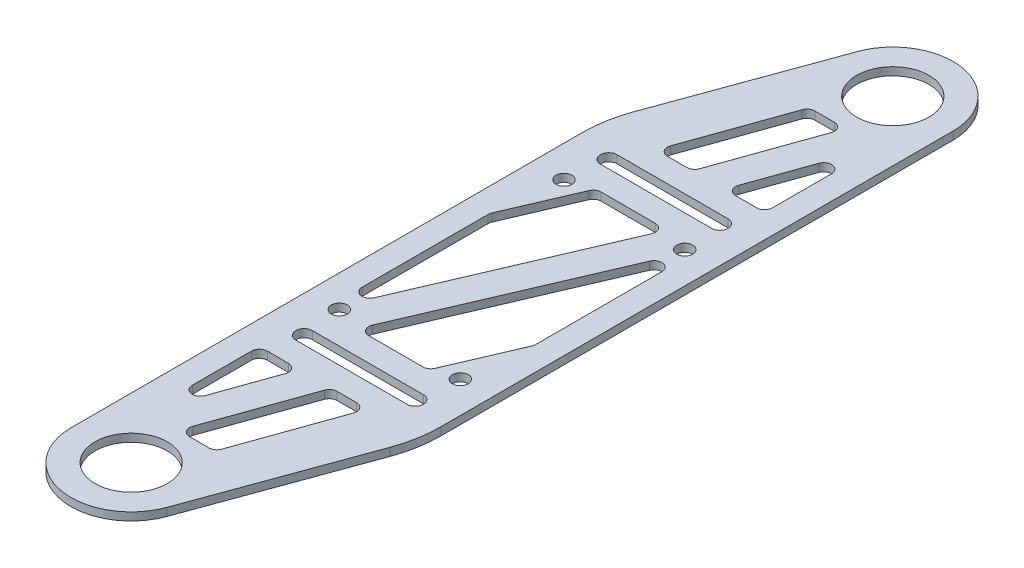
from build123d import *

# Parameters (mm, degrees)
SKETCH1_R           = 14.478
SKETCH1_R_2         = 3.175
BOSS_EXTRUDE1_DEPTH = 3.175
CUT_EXTRUDE1_DEPTH  = 168.948797034


with BuildPart() as part:
    # Sketch1 → Boss-Extrude1 (new body)
    with BuildSketch(Plane(origin=(0, 0, 0), x_dir=(1, 0, 0), z_dir=(0, 1, 0))):
        with BuildLine():
            Line((-36.83, 65.023620999), (-36.83, -139.7))
            ThreePointArc((-36.83, -139.7), (-16.890130527, -163.46341108), (9.97478294, -147.952946058))
            Line((9.97478294, -147.952946058), (33.766385136, -82.586056251))
            ThreePointArc((33.766385136, -82.586056251), (36.058233853, -74.032760396), (36.83, -65.21143297))
            Line((36.83, -65.21143297), (36.83, 139.7))
            ThreePointArc((36.83, 139.7), (17.75430807, 163.29472123), (-9.312633231, 149.584375461))
            Line((-9.312633231, 149.584375461), (-10.51620944, 146.277577002))
            Line((-10.51620944, 146.277577002), (-33.766385136, 82.39824428))
            ThreePointArc((-33.766385136, 82.39824428), (-36.058233853, 73.844948425), (-36.83, 65.023620999))
        make_face()
        with Locations(Location((-12.7, -139.7, 0), (0, 0, 270))):
            Circle(SKETCH1_R, mode=Mode.SUBTRACT)
        with Locations(Location((-24.13, -44.958, 0), (0, 0, 270))):
            Circle(SKETCH1_R_2, mode=Mode.SUBTRACT)
        with BuildLine():
            Line((22.225, -64.262), (-22.225, -64.262))
            ThreePointArc((-22.225, -64.262), (-25.527, -60.96), (-22.225, -57.658))
            Line((-22.225, -57.658), (22.225, -57.658))
            ThreePointArc((22.225, -57.658), (25.527, -60.96), (22.225, -64.262))
        make_face(mode=Mode.SUBTRACT)
        with Locations(Location((24.242138156, -44.897632473, 0), (0, 0, 270))):
            Circle(SKETCH1_R_2, mode=Mode.SUBTRACT)
        with Locations(Location((-24.13, 44.958, 0), (0, 0, 270))):
            Circle(SKETCH1_R_2, mode=Mode.SUBTRACT)
        with BuildLine():
            ThreePointArc((-22.225, 57.658), (-25.527, 60.96), (-22.225, 64.262))
            Line((-22.225, 64.262), (22.225, 64.262))
            ThreePointArc((22.225, 64.262), (25.527, 60.96), (22.225, 57.658))
            Line((22.225, 57.658), (-22.225, 57.658))
        make_face(mode=Mode.SUBTRACT)
        with Locations(Location((24.242138156, 44.897632473, 0), (0, 0, 270))):
            Circle(SKETCH1_R_2, mode=Mode.SUBTRACT)
        with Locations(Location((12.7, 139.7, 0), (0, 0, 270))):
            Circle(SKETCH1_R, mode=Mode.SUBTRACT)
    extrude(amount=BOSS_EXTRUDE1_DEPTH)

    # Sketch2 → Cut-Extrude1 (cut, through all)
    with BuildSketch(Plane(origin=(0, 3.175, 0), x_dir=(1, 0, 0), z_dir=(0, 1, 0))):
        with BuildLine():
            Line((-27.305, 17.780518249), (-27.305, -32.670889551))
            ThreePointArc((-27.305, -32.670889551), (-24.768631727, -35.780997992), (-21.21191369, -33.922047929))
            Line((-21.21191369, -33.922047929), (12.072240801, 43.706841622))
            ThreePointArc((12.072240801, 43.706841622), (11.804914085, 46.705597944), (9.154154491, 48.133))
            Line((9.154154491, 48.133), (-12.477385793, 48.133))
            ThreePointArc((-12.477385793, 48.133), (-14.224983737, 47.608759594), (-15.395472103, 46.209158378))
            Line((-15.395472103, 46.209158378), (-27.04808631, 19.031676627))
            ThreePointArc((-27.04808631, 19.031676627), (-27.240108441, 18.419149976), (-27.305, 17.780518249))
        make_face()
        with BuildLine():
            Line((27.305, -17.780518249), (27.305, 32.670889551))
            ThreePointArc((27.305, 32.670889551), (24.768631727, 35.780997992), (21.21191369, 33.922047929))
            Line((21.21191369, 33.922047929), (-12.072240801, -43.706841622))
            ThreePointArc((-12.072240801, -43.706841622), (-11.804914085, -46.705597944), (-9.154154491, -48.133))
            Line((-9.154154491, -48.133), (12.477385793, -48.133))
            ThreePointArc((12.477385793, -48.133), (14.224983737, -47.608759594), (15.395472103, -46.209158378))
            Line((15.395472103, -46.209158378), (27.04808631, -19.031676627))
            ThreePointArc((27.04808631, -19.031676627), (27.240108441, -18.419149976), (27.305, -17.780518249))
        make_face()
        with BuildLine():
            Line((-15.725871274, -73.787), (-24.13, -73.787))
            ThreePointArc((-24.13, -73.787), (-26.37506403, -74.71693597), (-27.305, -76.962))
            Line((-27.305, -76.962), (-27.305, -100.594783353))
            ThreePointArc((-27.305, -100.594783353), (-24.669761403, -103.723566283), (-21.138522754, -101.658592024))
            Line((-21.138522754, -101.658592024), (-12.734394028, -78.025808671))
            ThreePointArc((-12.734394028, -78.025808671), (-13.131818698, -75.131285321), (-15.725871274, -73.787))
        make_face()
        with BuildLine():
            Line((-9.990759398, -118.999), (-2.24070983, -118.999))
            ThreePointArc((-2.24070983, -118.999), (-0.409995151, -118.418052576), (0.750767416, -116.887808671))
            Line((0.750767416, -116.887808671), (14.570605972, -78.025808671))
            ThreePointArc((14.570605972, -78.025808671), (14.173181302, -75.131285321), (11.579128726, -73.787))
            Line((11.579128726, -73.787), (3.829079157, -73.787))
            ThreePointArc((3.829079157, -73.787), (1.998364479, -74.367947424), (0.837601912, -75.898191329))
            Line((0.837601912, -75.898191329), (-12.982236644, -114.760191329))
            ThreePointArc((-12.982236644, -114.760191329), (-12.584811974, -117.654714679), (-9.990759398, -118.999))
        make_face()
        with BuildLine():
            Line((15.725871274, 73.787), (24.13, 73.787))
            ThreePointArc((24.13, 73.787), (26.37506403, 74.71693597), (27.305, 76.962))
            Line((27.305, 76.962), (27.305, 100.594783353))
            ThreePointArc((27.305, 100.594783353), (24.669761403, 103.723566283), (21.138522754, 101.658592024))
            Line((21.138522754, 101.658592024), (12.734394028, 78.025808671))
            ThreePointArc((12.734394028, 78.025808671), (13.131818698, 75.131285321), (15.725871274, 73.787))
        make_face()
        with BuildLine():
            Line((9.990759398, 118.999), (2.24070983, 118.999))
            ThreePointArc((2.24070983, 118.999), (0.409995151, 118.418052576), (-0.750767416, 116.887808671))
            Line((-0.750767416, 116.887808671), (-14.570605972, 78.025808671))
            ThreePointArc((-14.570605972, 78.025808671), (-14.173181302, 75.131285321), (-11.579128726, 73.787))
            Line((-11.579128726, 73.787), (-3.829079157, 73.787))
            ThreePointArc((-3.829079157, 73.787), (-1.998364479, 74.367947424), (-0.837601912, 75.898191329))
            Line((-0.837601912, 75.898191329), (12.982236644, 114.760191329))
            ThreePointArc((12.982236644, 114.760191329), (12.584811974, 117.654714679), (9.990759398, 118.999))
        make_face()
    extrude(amount=-CUT_EXTRUDE1_DEPTH, mode=Mode.SUBTRACT)


solid = part.part
